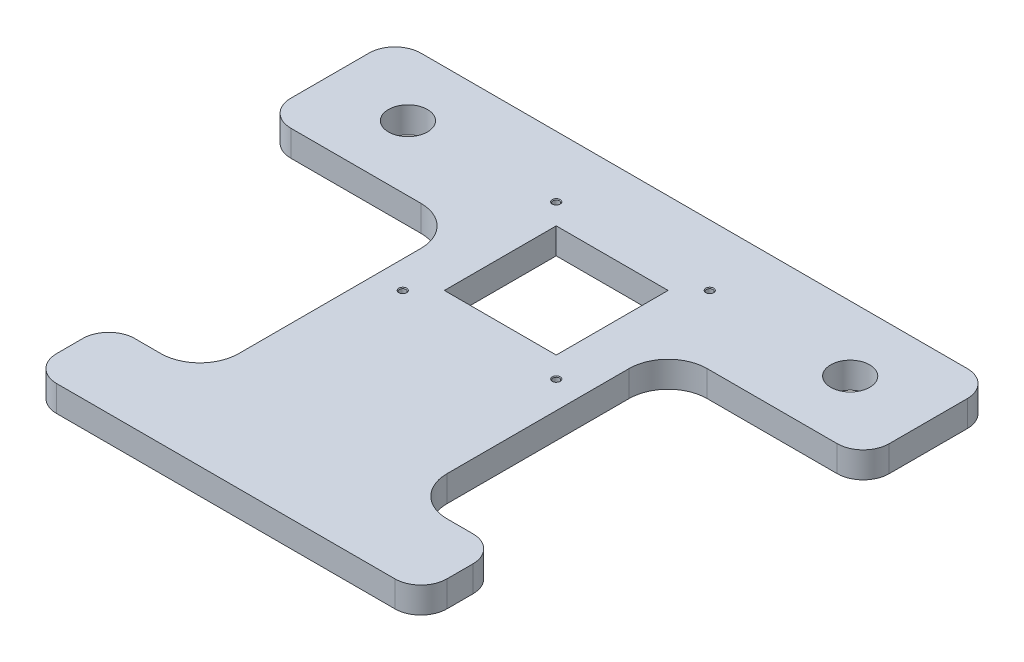
from build123d import *

# Parameters (mm, degrees)
AUFSATZ_LINEAR_AUSTRAGEN1_DEPTH  = 10
F_15_0_15_DURCHMESSER_BOHRUNG1_D = 15
SKIZZE8_W                        = 43
SKIZZE8_H                        = 43
SCHNITT_LINEAR_AUSTRAGEN2_DEPTH  = 10
M3_GEWINDEBOHRUNG1_D             = 2.5
M3_GEWINDEBOHRUNG1_DEPTH         = 8
M3_GEWINDEBOHRUNG1_CSINK_D       = 3.05
M3_GEWINDEBOHRUNG1_CSINK_ANGLE   = 90
M3_GEWINDEBOHRUNG1_TIP           = 0.751075774


with BuildPart() as part:
    # Skizze1 → Aufsatz-Linear austragen1 (new body)
    with BuildSketch(Plane(origin=(0, 0, 0), x_dir=(1, 0, 0), z_dir=(0, 1, 0))):
        with BuildLine():
            Line((-105, 90), (105, 90))
            ThreePointArc((105, 90), (112.071067812, 87.071067812), (115, 80))
            Line((115, 80), (115, 50))
            ThreePointArc((115, 50), (112.071067812, 42.928932188), (105, 40))
            Line((105, 40), (55, 40))
            ThreePointArc((55, 40), (44.393398282, 35.606601718), (40, 25))
            Line((40, 25), (40, -45))
            ThreePointArc((40, -45), (44.393398282, -55.606601718), (55, -60))
            Line((55, -60), (65, -60))
            ThreePointArc((65, -60), (72.071067812, -62.928932188), (75, -70))
            Line((75, -70), (75, -80))
            ThreePointArc((75, -80), (72.071067812, -87.071067812), (65, -90))
            Line((65, -90), (-65, -90))
            ThreePointArc((-65, -90), (-72.071067812, -87.071067812), (-75, -80))
            Line((-75, -80), (-75, -70))
            ThreePointArc((-75, -70), (-72.071067812, -62.928932188), (-65, -60))
            Line((-65, -60), (-55, -60))
            ThreePointArc((-55, -60), (-44.393398282, -55.606601718), (-40, -45))
            Line((-40, -45), (-40, 25))
            ThreePointArc((-40, 25), (-44.393398282, 35.606601718), (-55, 40))
            Line((-55, 40), (-105, 40))
            ThreePointArc((-105, 40), (-112.071067812, 42.928932188), (-115, 50))
            Line((-115, 50), (-115, 80))
            ThreePointArc((-115, 80), (-112.071067812, 87.071067812), (-105, 90))
        make_face()
    extrude(amount=AUFSATZ_LINEAR_AUSTRAGEN1_DEPTH)

    # Ø15.0 (15) Durchmesser Bohrung1 (through all)
    with Locations(Plane(origin=(0, 10, 0), x_dir=(1, 0, 0), z_dir=(0, 1, 0))):
        with Locations((-85, 65), (85, 65)):
            Hole(F_15_0_15_DURCHMESSER_BOHRUNG1_D / 2)

    # Skizze8 → Schnitt-Linear austragen2 (cut)
    with BuildSketch(Plane(origin=(0, 10, 0), x_dir=(1, 0, 0), z_dir=(0, 1, 0))):
        with Locations((0, 37)):
            Rectangle(SKIZZE8_W, SKIZZE8_H)
    extrude(amount=-SCHNITT_LINEAR_AUSTRAGEN2_DEPTH, mode=Mode.SUBTRACT)

    # M3 Gewindebohrung1
    with Locations(Plane(origin=(0, 10, 0), x_dir=(1, 0, 0), z_dir=(0, 1, 0))):
        with Locations((-29.5, 66.5), (-29.5, 7.5), (29.5, 7.5), (29.5, 66.5)):
            CounterSinkHole(M3_GEWINDEBOHRUNG1_D / 2, M3_GEWINDEBOHRUNG1_CSINK_D / 2, depth=M3_GEWINDEBOHRUNG1_DEPTH, counter_sink_angle=M3_GEWINDEBOHRUNG1_CSINK_ANGLE)
            with Locations((0, 0, -(M3_GEWINDEBOHRUNG1_DEPTH + M3_GEWINDEBOHRUNG1_TIP / 2))):  # 118° drill point
                Cone(0, M3_GEWINDEBOHRUNG1_D / 2, M3_GEWINDEBOHRUNG1_TIP, mode=Mode.SUBTRACT)


solid = part.part
